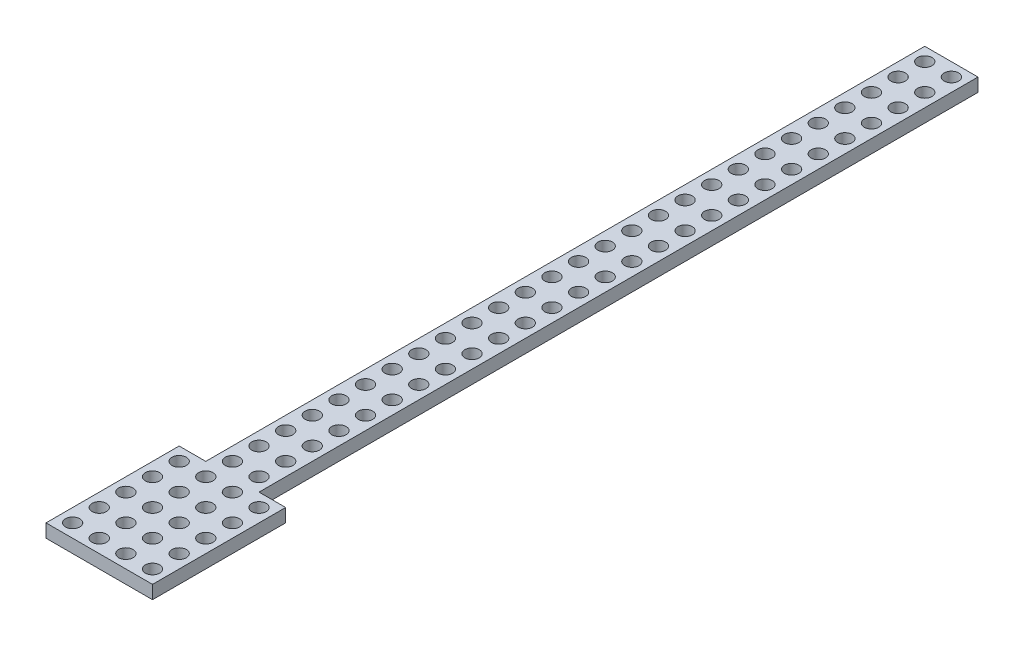
from build123d import *

# Parameters (mm, degrees)
SKETCH1_W           = 50.8
SKETCH1_H           = 406.4
SKETCH1_R           = 3.429
BOSS_EXTRUDE1_DEPTH = 6.35
SKETCH2_OUTSIDE_W   = 134.722
SKETCH2_OUTSIDE_H   = 490.322
CUT_EXTRUDE1_DEPTH  = 205.879775722


with BuildPart() as part:
    # Sketch1 → Boss-Extrude1 (new body)
    with BuildSketch(Plane(origin=(0, 0, 0), x_dir=(1, 0, 0), z_dir=(0, 1, 0))):
        Rectangle(SKETCH1_W, SKETCH1_H)
        with Locations(Location((-19.05, 196.85, 0), (0, 0, 270))):
            Circle(SKETCH1_R, mode=Mode.SUBTRACT)
        with Locations(Location((-6.35, 196.85, 0), (0, 0, 270))):
            Circle(SKETCH1_R, mode=Mode.SUBTRACT)
        with Locations(Location((6.35, 196.85, 0), (0, 0, 270))):
            Circle(SKETCH1_R, mode=Mode.SUBTRACT)
        with Locations(Location((19.05, 196.85, 0), (0, 0, 270))):
            Circle(SKETCH1_R, mode=Mode.SUBTRACT)
        with Locations(Location((-6.35, 184.15, 0), (0, 0, 270))):
            Circle(SKETCH1_R, mode=Mode.SUBTRACT)
        with Locations(Location((6.35, 184.15, 0), (0, 0, 270))):
            Circle(SKETCH1_R, mode=Mode.SUBTRACT)
        with Locations(Location((19.05, 184.15, 0), (0, 0, 270))):
            Circle(SKETCH1_R, mode=Mode.SUBTRACT)
        with Locations(Location((-6.35, 171.45, 0), (0, 0, 270))):
            Circle(SKETCH1_R, mode=Mode.SUBTRACT)
        with Locations(Location((6.35, 171.45, 0), (0, 0, 270))):
            Circle(SKETCH1_R, mode=Mode.SUBTRACT)
        with Locations(Location((19.05, 171.45, 0), (0, 0, 270))):
            Circle(SKETCH1_R, mode=Mode.SUBTRACT)
        with Locations(Location((-6.35, 158.75, 0), (0, 0, 270))):
            Circle(SKETCH1_R, mode=Mode.SUBTRACT)
        with Locations(Location((6.35, 158.75, 0), (0, 0, 270))):
            Circle(SKETCH1_R, mode=Mode.SUBTRACT)
        with Locations(Location((19.05, 158.75, 0), (0, 0, 270))):
            Circle(SKETCH1_R, mode=Mode.SUBTRACT)
        with Locations(Location((-6.35, 146.05, 0), (0, 0, 270))):
            Circle(SKETCH1_R, mode=Mode.SUBTRACT)
        with Locations(Location((6.35, 146.05, 0), (0, 0, 270))):
            Circle(SKETCH1_R, mode=Mode.SUBTRACT)
        with Locations(Location((19.05, 146.05, 0), (0, 0, 270))):
            Circle(SKETCH1_R, mode=Mode.SUBTRACT)
        with Locations(Location((-6.35, 133.35, 0), (0, 0, 270))):
            Circle(SKETCH1_R, mode=Mode.SUBTRACT)
        with Locations(Location((6.35, 133.35, 0), (0, 0, 270))):
            Circle(SKETCH1_R, mode=Mode.SUBTRACT)
        with Locations(Location((19.05, 133.35, 0), (0, 0, 270))):
            Circle(SKETCH1_R, mode=Mode.SUBTRACT)
        with Locations(Location((-6.35, 120.65, 0), (0, 0, 270))):
            Circle(SKETCH1_R, mode=Mode.SUBTRACT)
        with Locations(Location((6.35, 120.65, 0), (0, 0, 270))):
            Circle(SKETCH1_R, mode=Mode.SUBTRACT)
        with Locations(Location((19.05, 120.65, 0), (0, 0, 270))):
            Circle(SKETCH1_R, mode=Mode.SUBTRACT)
        with Locations(Location((-6.35, 107.95, 0), (0, 0, 270))):
            Circle(SKETCH1_R, mode=Mode.SUBTRACT)
        with Locations(Location((6.35, 107.95, 0), (0, 0, 270))):
            Circle(SKETCH1_R, mode=Mode.SUBTRACT)
        with Locations(Location((19.05, 107.95, 0), (0, 0, 270))):
            Circle(SKETCH1_R, mode=Mode.SUBTRACT)
        with Locations(Location((-6.35, 95.25, 0), (0, 0, 270))):
            Circle(SKETCH1_R, mode=Mode.SUBTRACT)
        with Locations(Location((6.35, 95.25, 0), (0, 0, 270))):
            Circle(SKETCH1_R, mode=Mode.SUBTRACT)
        with Locations(Location((19.05, 95.25, 0), (0, 0, 270))):
            Circle(SKETCH1_R, mode=Mode.SUBTRACT)
        with Locations(Location((-6.35, 82.55, 0), (0, 0, 270))):
            Circle(SKETCH1_R, mode=Mode.SUBTRACT)
        with Locations(Location((6.35, 82.55, 0), (0, 0, 270))):
            Circle(SKETCH1_R, mode=Mode.SUBTRACT)
        with Locations(Location((19.05, 82.55, 0), (0, 0, 270))):
            Circle(SKETCH1_R, mode=Mode.SUBTRACT)
        with Locations(Location((-6.35, 69.85, 0), (0, 0, 270))):
            Circle(SKETCH1_R, mode=Mode.SUBTRACT)
        with Locations(Location((6.35, 69.85, 0), (0, 0, 270))):
            Circle(SKETCH1_R, mode=Mode.SUBTRACT)
        with Locations(Location((19.05, 69.85, 0), (0, 0, 270))):
            Circle(SKETCH1_R, mode=Mode.SUBTRACT)
        with Locations(Location((-6.35, 57.15, 0), (0, 0, 270))):
            Circle(SKETCH1_R, mode=Mode.SUBTRACT)
        with Locations(Location((6.35, 57.15, 0), (0, 0, 270))):
            Circle(SKETCH1_R, mode=Mode.SUBTRACT)
        with Locations(Location((19.05, 57.15, 0), (0, 0, 270))):
            Circle(SKETCH1_R, mode=Mode.SUBTRACT)
        with Locations(Location((-6.35, 44.45, 0), (0, 0, 270))):
            Circle(SKETCH1_R, mode=Mode.SUBTRACT)
        with Locations(Location((6.35, 44.45, 0), (0, 0, 270))):
            Circle(SKETCH1_R, mode=Mode.SUBTRACT)
        with Locations(Location((19.05, 44.45, 0), (0, 0, 270))):
            Circle(SKETCH1_R, mode=Mode.SUBTRACT)
        with Locations(Location((-6.35, 31.75, 0), (0, 0, 270))):
            Circle(SKETCH1_R, mode=Mode.SUBTRACT)
        with Locations(Location((6.35, 31.75, 0), (0, 0, 270))):
            Circle(SKETCH1_R, mode=Mode.SUBTRACT)
        with Locations(Location((19.05, 31.75, 0), (0, 0, 270))):
            Circle(SKETCH1_R, mode=Mode.SUBTRACT)
        with Locations(Location((-6.35, 19.05, 0), (0, 0, 270))):
            Circle(SKETCH1_R, mode=Mode.SUBTRACT)
        with Locations(Location((6.35, 19.05, 0), (0, 0, 270))):
            Circle(SKETCH1_R, mode=Mode.SUBTRACT)
        with Locations(Location((19.05, 19.05, 0), (0, 0, 270))):
            Circle(SKETCH1_R, mode=Mode.SUBTRACT)
        with Locations(Location((-6.35, 6.35, 0), (0, 0, 270))):
            Circle(SKETCH1_R, mode=Mode.SUBTRACT)
        with Locations(Location((6.35, 6.35, 0), (0, 0, 270))):
            Circle(SKETCH1_R, mode=Mode.SUBTRACT)
        with Locations(Location((19.05, 6.35, 0), (0, 0, 270))):
            Circle(SKETCH1_R, mode=Mode.SUBTRACT)
        with Locations(Location((-6.35, -6.35, 0), (0, 0, 270))):
            Circle(SKETCH1_R, mode=Mode.SUBTRACT)
        with Locations(Location((6.35, -6.35, 0), (0, 0, 270))):
            Circle(SKETCH1_R, mode=Mode.SUBTRACT)
        with Locations(Location((19.05, -6.35, 0), (0, 0, 270))):
            Circle(SKETCH1_R, mode=Mode.SUBTRACT)
        with Locations(Location((-6.35, -19.05, 0), (0, 0, 270))):
            Circle(SKETCH1_R, mode=Mode.SUBTRACT)
        with Locations(Location((6.35, -19.05, 0), (0, 0, 270))):
            Circle(SKETCH1_R, mode=Mode.SUBTRACT)
        with Locations(Location((19.05, -19.05, 0), (0, 0, 270))):
            Circle(SKETCH1_R, mode=Mode.SUBTRACT)
        with Locations(Location((-6.35, -31.75, 0), (0, 0, 270))):
            Circle(SKETCH1_R, mode=Mode.SUBTRACT)
        with Locations(Location((6.35, -31.75, 0), (0, 0, 270))):
            Circle(SKETCH1_R, mode=Mode.SUBTRACT)
        with Locations(Location((19.05, -31.75, 0), (0, 0, 270))):
            Circle(SKETCH1_R, mode=Mode.SUBTRACT)
        with Locations(Location((-6.35, -44.45, 0), (0, 0, 270))):
            Circle(SKETCH1_R, mode=Mode.SUBTRACT)
        with Locations(Location((6.35, -44.45, 0), (0, 0, 270))):
            Circle(SKETCH1_R, mode=Mode.SUBTRACT)
        with Locations(Location((19.05, -44.45, 0), (0, 0, 270))):
            Circle(SKETCH1_R, mode=Mode.SUBTRACT)
        with Locations(Location((-19.05, 184.15, 0), (0, 0, 270))):
            Circle(SKETCH1_R, mode=Mode.SUBTRACT)
        with Locations(Location((-19.05, 171.45, 0), (0, 0, 270))):
            Circle(SKETCH1_R, mode=Mode.SUBTRACT)
        with Locations(Location((-19.05, 158.75, 0), (0, 0, 270))):
            Circle(SKETCH1_R, mode=Mode.SUBTRACT)
        with Locations(Location((-19.05, 146.05, 0), (0, 0, 270))):
            Circle(SKETCH1_R, mode=Mode.SUBTRACT)
        with Locations(Location((-19.05, 133.35, 0), (0, 0, 270))):
            Circle(SKETCH1_R, mode=Mode.SUBTRACT)
        with Locations(Location((-19.05, 120.65, 0), (0, 0, 270))):
            Circle(SKETCH1_R, mode=Mode.SUBTRACT)
        with Locations(Location((-19.05, 107.95, 0), (0, 0, 270))):
            Circle(SKETCH1_R, mode=Mode.SUBTRACT)
        with Locations(Location((-19.05, 95.25, 0), (0, 0, 270))):
            Circle(SKETCH1_R, mode=Mode.SUBTRACT)
        with Locations(Location((-19.05, 82.55, 0), (0, 0, 270))):
            Circle(SKETCH1_R, mode=Mode.SUBTRACT)
        with Locations(Location((-19.05, 69.85, 0), (0, 0, 270))):
            Circle(SKETCH1_R, mode=Mode.SUBTRACT)
        with Locations(Location((-19.05, 57.15, 0), (0, 0, 270))):
            Circle(SKETCH1_R, mode=Mode.SUBTRACT)
        with Locations(Location((-19.05, 44.45, 0), (0, 0, 270))):
            Circle(SKETCH1_R, mode=Mode.SUBTRACT)
        with Locations(Location((-19.05, 31.75, 0), (0, 0, 270))):
            Circle(SKETCH1_R, mode=Mode.SUBTRACT)
        with Locations(Location((-19.05, 19.05, 0), (0, 0, 270))):
            Circle(SKETCH1_R, mode=Mode.SUBTRACT)
        with Locations(Location((-19.05, 6.35, 0), (0, 0, 270))):
            Circle(SKETCH1_R, mode=Mode.SUBTRACT)
        with Locations(Location((-19.05, -6.35, 0), (0, 0, 270))):
            Circle(SKETCH1_R, mode=Mode.SUBTRACT)
        with Locations(Location((-19.05, -19.05, 0), (0, 0, 270))):
            Circle(SKETCH1_R, mode=Mode.SUBTRACT)
        with Locations(Location((-19.05, -31.75, 0), (0, 0, 270))):
            Circle(SKETCH1_R, mode=Mode.SUBTRACT)
        with Locations(Location((-19.05, -44.45, 0), (0, 0, 270))):
            Circle(SKETCH1_R, mode=Mode.SUBTRACT)
        with Locations(Location((-19.05, -57.15, 0), (0, 0, 270))):
            Circle(SKETCH1_R, mode=Mode.SUBTRACT)
        with Locations(Location((-6.35, -57.15, 0), (0, 0, 270))):
            Circle(SKETCH1_R, mode=Mode.SUBTRACT)
        with Locations(Location((6.35, -57.15, 0), (0, 0, 270))):
            Circle(SKETCH1_R, mode=Mode.SUBTRACT)
        with Locations(Location((19.05, -57.15, 0), (0, 0, 270))):
            Circle(SKETCH1_R, mode=Mode.SUBTRACT)
        with Locations(Location((-19.05, -69.85, 0), (0, 0, 270))):
            Circle(SKETCH1_R, mode=Mode.SUBTRACT)
        with Locations(Location((-6.35, -69.85, 0), (0, 0, 270))):
            Circle(SKETCH1_R, mode=Mode.SUBTRACT)
        with Locations(Location((6.35, -69.85, 0), (0, 0, 270))):
            Circle(SKETCH1_R, mode=Mode.SUBTRACT)
        with Locations(Location((19.05, -69.85, 0), (0, 0, 270))):
            Circle(SKETCH1_R, mode=Mode.SUBTRACT)
        with Locations(Location((-19.05, -82.55, 0), (0, 0, 270))):
            Circle(SKETCH1_R, mode=Mode.SUBTRACT)
        with Locations(Location((-6.35, -82.55, 0), (0, 0, 270))):
            Circle(SKETCH1_R, mode=Mode.SUBTRACT)
        with Locations(Location((6.35, -82.55, 0), (0, 0, 270))):
            Circle(SKETCH1_R, mode=Mode.SUBTRACT)
        with Locations(Location((19.05, -82.55, 0), (0, 0, 270))):
            Circle(SKETCH1_R, mode=Mode.SUBTRACT)
        with Locations(Location((-19.05, -95.25, 0), (0, 0, 270))):
            Circle(SKETCH1_R, mode=Mode.SUBTRACT)
        with Locations(Location((-6.35, -95.25, 0), (0, 0, 270))):
            Circle(SKETCH1_R, mode=Mode.SUBTRACT)
        with Locations(Location((6.35, -95.25, 0), (0, 0, 270))):
            Circle(SKETCH1_R, mode=Mode.SUBTRACT)
        with Locations(Location((19.05, -95.25, 0), (0, 0, 270))):
            Circle(SKETCH1_R, mode=Mode.SUBTRACT)
        with Locations(Location((-19.05, -107.95, 0), (0, 0, 270))):
            Circle(SKETCH1_R, mode=Mode.SUBTRACT)
        with Locations(Location((-6.35, -107.95, 0), (0, 0, 270))):
            Circle(SKETCH1_R, mode=Mode.SUBTRACT)
        with Locations(Location((6.35, -107.95, 0), (0, 0, 270))):
            Circle(SKETCH1_R, mode=Mode.SUBTRACT)
        with Locations(Location((19.05, -107.95, 0), (0, 0, 270))):
            Circle(SKETCH1_R, mode=Mode.SUBTRACT)
        with Locations(Location((-19.05, -120.65, 0), (0, 0, 270))):
            Circle(SKETCH1_R, mode=Mode.SUBTRACT)
        with Locations(Location((-6.35, -120.65, 0), (0, 0, 270))):
            Circle(SKETCH1_R, mode=Mode.SUBTRACT)
        with Locations(Location((6.35, -120.65, 0), (0, 0, 270))):
            Circle(SKETCH1_R, mode=Mode.SUBTRACT)
        with Locations(Location((19.05, -120.65, 0), (0, 0, 270))):
            Circle(SKETCH1_R, mode=Mode.SUBTRACT)
        with Locations(Location((-19.05, -133.35, 0), (0, 0, 270))):
            Circle(SKETCH1_R, mode=Mode.SUBTRACT)
        with Locations(Location((-6.35, -133.35, 0), (0, 0, 270))):
            Circle(SKETCH1_R, mode=Mode.SUBTRACT)
        with Locations(Location((6.35, -133.35, 0), (0, 0, 270))):
            Circle(SKETCH1_R, mode=Mode.SUBTRACT)
        with Locations(Location((19.05, -133.35, 0), (0, 0, 270))):
            Circle(SKETCH1_R, mode=Mode.SUBTRACT)
        with Locations(Location((-19.05, -146.05, 0), (0, 0, 270))):
            Circle(SKETCH1_R, mode=Mode.SUBTRACT)
        with Locations(Location((-6.35, -146.05, 0), (0, 0, 270))):
            Circle(SKETCH1_R, mode=Mode.SUBTRACT)
        with Locations(Location((6.35, -146.05, 0), (0, 0, 270))):
            Circle(SKETCH1_R, mode=Mode.SUBTRACT)
        with Locations(Location((19.05, -146.05, 0), (0, 0, 270))):
            Circle(SKETCH1_R, mode=Mode.SUBTRACT)
        with Locations(Location((-19.05, -158.75, 0), (0, 0, 270))):
            Circle(SKETCH1_R, mode=Mode.SUBTRACT)
        with Locations(Location((-6.35, -158.75, 0), (0, 0, 270))):
            Circle(SKETCH1_R, mode=Mode.SUBTRACT)
        with Locations(Location((6.35, -158.75, 0), (0, 0, 270))):
            Circle(SKETCH1_R, mode=Mode.SUBTRACT)
        with Locations(Location((19.05, -158.75, 0), (0, 0, 270))):
            Circle(SKETCH1_R, mode=Mode.SUBTRACT)
        with Locations(Location((-19.05, -171.45, 0), (0, 0, 270))):
            Circle(SKETCH1_R, mode=Mode.SUBTRACT)
        with Locations(Location((-6.35, -171.45, 0), (0, 0, 270))):
            Circle(SKETCH1_R, mode=Mode.SUBTRACT)
        with Locations(Location((6.35, -171.45, 0), (0, 0, 270))):
            Circle(SKETCH1_R, mode=Mode.SUBTRACT)
        with Locations(Location((19.05, -171.45, 0), (0, 0, 270))):
            Circle(SKETCH1_R, mode=Mode.SUBTRACT)
        with Locations(Location((-19.05, -184.15, 0), (0, 0, 270))):
            Circle(SKETCH1_R, mode=Mode.SUBTRACT)
        with Locations(Location((-6.35, -184.15, 0), (0, 0, 270))):
            Circle(SKETCH1_R, mode=Mode.SUBTRACT)
        with Locations(Location((6.35, -184.15, 0), (0, 0, 270))):
            Circle(SKETCH1_R, mode=Mode.SUBTRACT)
        with Locations(Location((19.05, -184.15, 0), (0, 0, 270))):
            Circle(SKETCH1_R, mode=Mode.SUBTRACT)
        with Locations(Location((-19.05, -196.85, 0), (0, 0, 270))):
            Circle(SKETCH1_R, mode=Mode.SUBTRACT)
        with Locations(Location((-6.35, -196.85, 0), (0, 0, 270))):
            Circle(SKETCH1_R, mode=Mode.SUBTRACT)
        with Locations(Location((6.35, -196.85, 0), (0, 0, 270))):
            Circle(SKETCH1_R, mode=Mode.SUBTRACT)
        with Locations(Location((19.05, -196.85, 0), (0, 0, 270))):
            Circle(SKETCH1_R, mode=Mode.SUBTRACT)
    extrude(amount=BOSS_EXTRUDE1_DEPTH)

    # Sketch2 outside → Cut-Extrude1 (cut, through all)
    with BuildSketch(Plane(origin=(0, 6.35, 0), x_dir=(1, 0, 0), z_dir=(0, 1, 0))):
        Rectangle(SKETCH2_OUTSIDE_W, SKETCH2_OUTSIDE_H)
        Polygon((-12.7, 203.2), (-12.7, -139.7), (-25.4, -139.7), (-25.4, -203.2), (25.4, -203.2), (25.4, -139.7), (12.7, -139.7), (12.7, 203.2), align=None, mode=Mode.SUBTRACT)
    extrude(amount=-CUT_EXTRUDE1_DEPTH, mode=Mode.SUBTRACT)


solid = part.part
